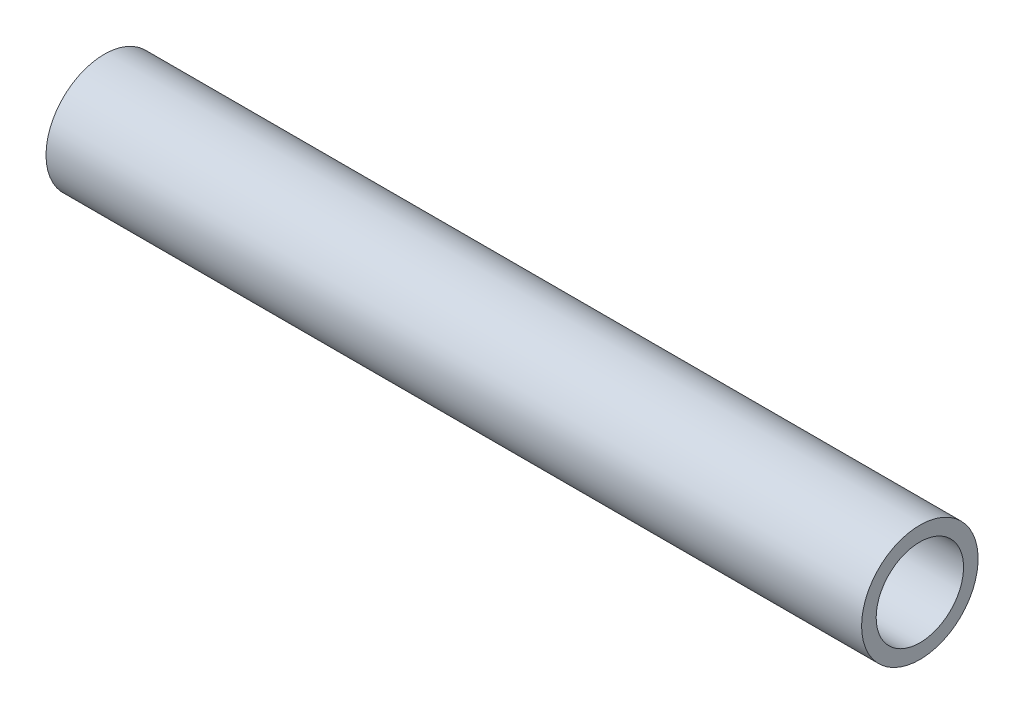
from build123d import *

# Parameters (mm, degrees)
SKETCH1_W = 140
SKETCH1_H = 2.5


with BuildPart() as part:
    # Sketch1 → Revolve1 (revolve)
    with BuildSketch(Plane.XY, mode=Mode.PRIVATE) as revolve1_sk:
        with Locations((100, 8.75)):
            Rectangle(SKETCH1_W, SKETCH1_H)
    revolve(revolve1_sk.sketch.rotate(Axis((0, 0, 0), (1, 0, 0)), 90), axis=Axis((0, 0, 0), (1, 0, 0)))


solid = part.part
